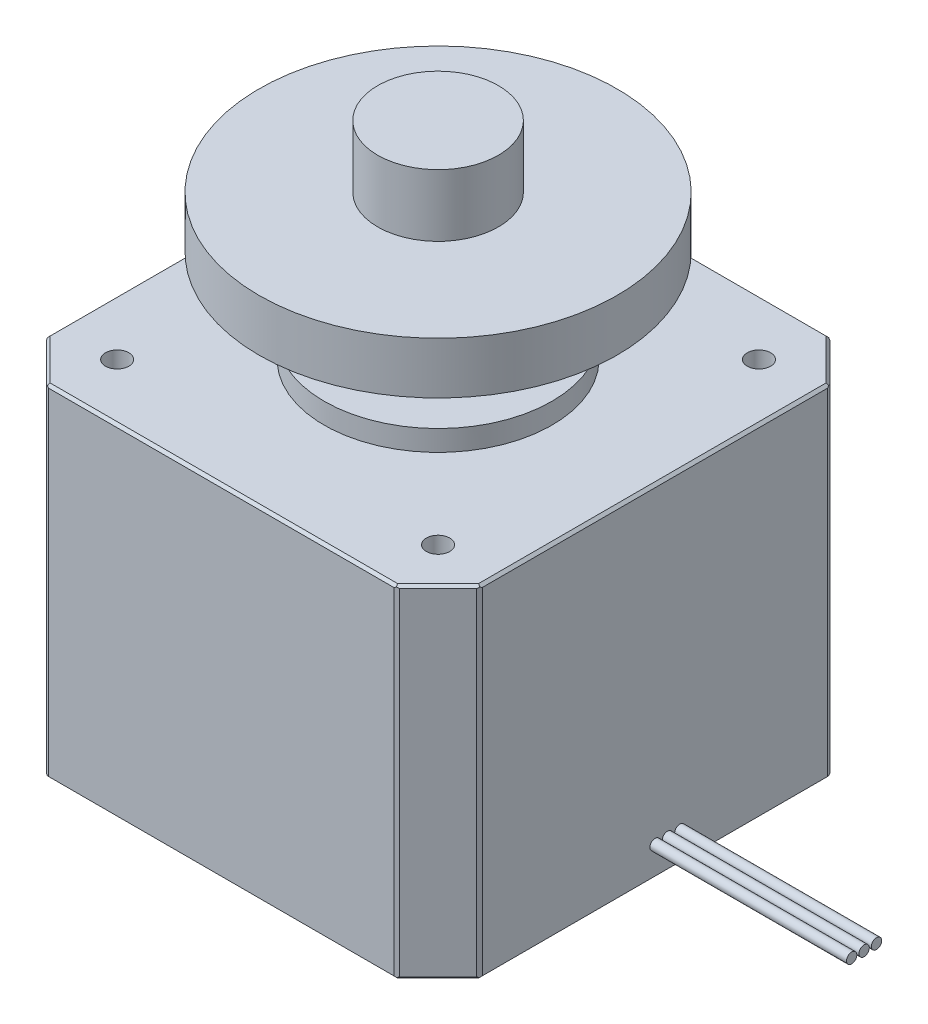
from build123d import *
from OCP.BRepFilletAPI import BRepFilletAPI_MakeChamfer

# Parameters (mm, degrees)
SKETCH1_W                 = 41.91
SKETCH1_H                 = 41.91
EXTRUDE1_DEPTH            = 33
SKETCH9_R                 = 11
EXTRUDE5_DEPTH            = 2
SKETCH7_R                 = 2.50063
EXTRUDE3_DEPTH            = 18
F_4_40_TAPPED_HOLE1_D     = 2.2606
F_4_40_TAPPED_HOLE1_DEPTH = 6.41
F_4_40_TAPPED_HOLE1_TIP   = 0.679152758
F_4_40_TAPPED_HOLE2_D     = 2.2606
F_4_40_TAPPED_HOLE2_DEPTH = 29.905
F_4_40_TAPPED_HOLE2_TIP   = 0.679152758
SKETCH14_R                = 3.1
CUT_EXTRUDE1_DEPTH        = 2.6
CHAMFER1_SIZE             = 0.508
CHAMFER2_SIZE             = 4.064
SKETCH16_R                = 3.3147
CUT_EXTRUDE3_DEPTH        = 5.08
BOSS_EXTRUDE1_START       = 4.08
SKETCH17_R                = 2.50063
BOSS_EXTRUDE1_DEPTH       = 4.08
CHAMFER3_SIZE             = 0.254
CHAMFER4_SIZE             = 0.254
CHAMFER4_SIZE2            = 0.205559306
SKETCH18_W                = 5.00126
SKETCH18_H                = 1
CUT_EXTRUDE4_DEPTH        = 15
SKETCH24_R                = 0.5
BOSS_EXTRUDE2_DEPTH       = 19
SKETCH25_R                = 5.83
BOSS_EXTRUDE3_DEPTH       = 14
SKETCH26_R                = 17.29
BOSS_EXTRUDE4_DEPTH       = 11
SKETCH27_R                = 17.29
SKETCH27_R_2              = 5.83
CUT_EXTRUDE5_DEPTH        = 6


with BuildPart() as part:
    # Sketch1 → Extrude1 (new body)
    with BuildSketch(Plane(origin=(0, 0, 0), x_dir=(1, 0, 0), z_dir=(0, 1, 0))):
        Rectangle(SKETCH1_W, SKETCH1_H)
    extrude(amount=-EXTRUDE1_DEPTH)

    # Sketch9 → Extrude5 (add)
    with BuildSketch(Plane(origin=(0, 0, 0), x_dir=(1, 0, 0), z_dir=(0, 1, 0))):
        with Locations(Location((0, 0, 0), (0, 0, 90))):
            Circle(SKETCH9_R)
    extrude(amount=EXTRUDE5_DEPTH)

    # Sketch7 → Extrude3 (add)
    with BuildSketch(Plane(origin=(0, 2, 0), x_dir=(-1, 0, 0), z_dir=(0, 1, 0))):
        with Locations(Location((0, 0, 0), (0, 0, 90))):
            Circle(SKETCH7_R)
    extrude(amount=EXTRUDE3_DEPTH)

    # #4-40 Tapped Hole1
    with Locations(Plane(origin=(0, 0, 0), x_dir=(-1, 0, 0), z_dir=(0, 1, 0))):
        with Locations((15.5, -15.5), (15.5, 15.5), (-15.5, 15.5), (-15.5, -15.5)):
            Hole(F_4_40_TAPPED_HOLE1_D / 2, depth=F_4_40_TAPPED_HOLE1_DEPTH)
            with Locations((0, 0, -(F_4_40_TAPPED_HOLE1_DEPTH + F_4_40_TAPPED_HOLE1_TIP / 2))):  # 118° drill point
                Cone(0, F_4_40_TAPPED_HOLE1_D / 2, F_4_40_TAPPED_HOLE1_TIP, mode=Mode.SUBTRACT)

    # #4-40 Tapped Hole2
    with Locations(Plane.XZ.offset(33)):
        with Locations((15.5, -15.5), (-15.5, 15.5), (-15.5, -15.5), (15.5, 15.5)):
            Hole(F_4_40_TAPPED_HOLE2_D / 2, depth=F_4_40_TAPPED_HOLE2_DEPTH)
            with Locations((0, 0, -(F_4_40_TAPPED_HOLE2_DEPTH + F_4_40_TAPPED_HOLE2_TIP / 2))):  # 118° drill point
                Cone(0, F_4_40_TAPPED_HOLE2_D / 2, F_4_40_TAPPED_HOLE2_TIP, mode=Mode.SUBTRACT)

    # Sketch14 → Cut-Extrude1 (cut)
    with BuildSketch(Plane(origin=(0, -33, 0), x_dir=(1, 0, 0), z_dir=(0, 1, 0))):
        with Locations(Location((15.5, 15.5, 0), (0, 0, 270))):
            Circle(SKETCH14_R)
        with Locations(Location((-15.5, 15.5, 0), (0, 0, 270))):
            Circle(SKETCH14_R)
        with Locations(Location((-15.5, -15.5, 0), (0, 0, 270))):
            Circle(SKETCH14_R)
        with Locations(Location((15.5, -15.5, 0), (0, 0, 270))):
            Circle(SKETCH14_R)
    extrude(amount=CUT_EXTRUDE1_DEPTH, mode=Mode.SUBTRACT)

    # Chamfer1
    chamfer1_edges = [part.edges().sort_by_distance(p)[0] for p in [
        (0, 20, -2.50063),
    ]]
    chamfer(chamfer1_edges, length=CHAMFER1_SIZE)

    # Chamfer2
    chamfer2_edges = [part.edges().sort_by_distance(p)[0] for p in [
        (20.955, -16.5, 20.955),
        (-20.955, -16.5, 20.955),
        (-20.955, -16.5, -20.955),
        (20.955, -16.5, -20.955),
    ]]
    chamfer(chamfer2_edges, length=CHAMFER2_SIZE)

    # Sketch16 → Cut-Extrude3 (cut)
    with BuildSketch(Plane.XZ.offset(33)):
        with Locations(Location((0, 0, 0), (0, 0, 270))):
            Circle(SKETCH16_R)
    extrude(amount=-CUT_EXTRUDE3_DEPTH, mode=Mode.SUBTRACT)

    # Sketch17 → Boss-Extrude1 (add)
    with BuildSketch(Plane.XZ.offset(27.92).offset(BOSS_EXTRUDE1_START)):
        with Locations(Location((0, 0, 0), (0, 0, 90))):
            Circle(SKETCH17_R)
    extrude(amount=-BOSS_EXTRUDE1_DEPTH)

    # Chamfer3
    chamfer3_edges = [part.edges().sort_by_distance(p)[0] for p in [
        (-18.923, -33, 18.923),
        (0, -33, 3.3147),
        (0, -32, -2.50063),
        (-20.955, 0, 0),
        (-20.955, -33, 0),
        (20.955, 0, 0),
        (0, 0, -20.955),
        (0, 0, 20.955),
        (-18.923, 0, -18.923),
        (18.923, 0, -18.923),
        (18.923, 0, 18.923),
        (-18.923, 0, 18.923),
        (0, -33, 20.955),
        (20.955, -33, 0),
        (0, -33, -20.955),
        (-18.923, -33, -18.923),
        (18.923, -33, -18.923),
        (18.923, -33, 18.923),
    ]]
    chamfer(chamfer3_edges, length=CHAMFER3_SIZE)

    # Chamfer4: one chamfer whose edges measure the first distance from different faces: ONE call of the kernel's chamfer builder (chamfer() names one face for all edges)
    chamfer4_edges_1 = [part.edges().sort_by_distance(p)[0] for p in [
        (16.891, -16.5, -20.955),
        (20.955, -16.5, -16.891),
    ]]
    chamfer4_side_1 = [part.faces().sort_by_distance(p)[0] for p in [
        (18.923, -16.5, -18.923),
    ]]
    chamfer4_edges_2 = [part.edges().sort_by_distance(p)[0] for p in [
        (-16.891, -16.5, -20.955),
        (-20.955, -16.5, -16.891),
    ]]
    chamfer4_side_2 = [part.faces().sort_by_distance(p)[0] for p in [
        (-18.923, -16.5, -18.923),
    ]]
    chamfer4_edges_3 = [part.edges().sort_by_distance(p)[0] for p in [
        (20.955, -16.5, 16.891),
        (16.891, -16.5, 20.955),
    ]]
    chamfer4_side_3 = [part.faces().sort_by_distance(p)[0] for p in [
        (18.923, -16.5, 18.923),
    ]]
    chamfer4_edges_4 = [part.edges().sort_by_distance(p)[0] for p in [
        (-16.891, -16.5, 20.955),
        (-20.955, -16.5, 16.891),
    ]]
    chamfer4_side_4 = [part.faces().sort_by_distance(p)[0] for p in [
        (-18.923, -16.5, 18.923),
    ]]
    chamfer4 = BRepFilletAPI_MakeChamfer(part.part.solid().wrapped)
    for e in chamfer4_edges_1:
        chamfer4.Add(CHAMFER4_SIZE, CHAMFER4_SIZE2, e.wrapped, chamfer4_side_1[0].wrapped)  # the first distance lies on this face
    for e in chamfer4_edges_2:
        chamfer4.Add(CHAMFER4_SIZE, CHAMFER4_SIZE2, e.wrapped, chamfer4_side_2[0].wrapped)  # the first distance lies on this face
    for e in chamfer4_edges_3:
        chamfer4.Add(CHAMFER4_SIZE, CHAMFER4_SIZE2, e.wrapped, chamfer4_side_3[0].wrapped)  # the first distance lies on this face
    for e in chamfer4_edges_4:
        chamfer4.Add(CHAMFER4_SIZE, CHAMFER4_SIZE2, e.wrapped, chamfer4_side_4[0].wrapped)  # the first distance lies on this face
    add(Compound.cast(chamfer4.Shape()), mode=Mode.REPLACE)

    # Sketch18 → Cut-Extrude4 (cut)
    with BuildSketch(Plane(origin=(0, 20, 0), x_dir=(1, 0, 0), z_dir=(0, 1, 0))):
        with Locations((0, 2.50063)):
            Rectangle(SKETCH18_W, SKETCH18_H)
    extrude(amount=-CUT_EXTRUDE4_DEPTH, mode=Mode.SUBTRACT)

    # Sketch24 → Boss-Extrude2 (add)
    with BuildSketch(Plane(origin=(20.955, 0, 0), x_dir=(0, 0, -1), z_dir=(1, 0, 0))):
        with Locations((2.4, -30.086520784)):
            Circle(SKETCH24_R)
        with Locations((1.2, -30.086520784)):
            Circle(SKETCH24_R)
        with Locations((0, -30.086520784)):
            Circle(SKETCH24_R)
    extrude(amount=BOSS_EXTRUDE2_DEPTH)

    # Sketch25 → Boss-Extrude3 (add)
    with BuildSketch(Plane(origin=(0, 20, 0), x_dir=(1, 0, 0), z_dir=(0, 1, 0))):
        with Locations(Location((0, 0, 0), (0, 0, 270))):
            Circle(SKETCH25_R)
    extrude(amount=-BOSS_EXTRUDE3_DEPTH)

    # Sketch26 → Boss-Extrude4 (add)
    with BuildSketch(Plane(origin=(0, 20, 0), x_dir=(1, 0, 0), z_dir=(0, 1, 0))):
        with Locations(Location((0, 0, 0), (0, 0, 270))):
            Circle(SKETCH26_R)
    extrude(amount=-BOSS_EXTRUDE4_DEPTH)

    # Sketch27 → Cut-Extrude5 (cut)
    with BuildSketch(Plane(origin=(0, 20, 0), x_dir=(1, 0, 0), z_dir=(0, 1, 0))):
        with Locations(Location((0, 0, 0), (0, 0, 270))):
            Circle(SKETCH27_R)
        with Locations(Location((0, 0, 0), (0, 0, 270))):
            Circle(SKETCH27_R_2, mode=Mode.SUBTRACT)
    extrude(amount=-CUT_EXTRUDE5_DEPTH, mode=Mode.SUBTRACT)


solid = part.part
